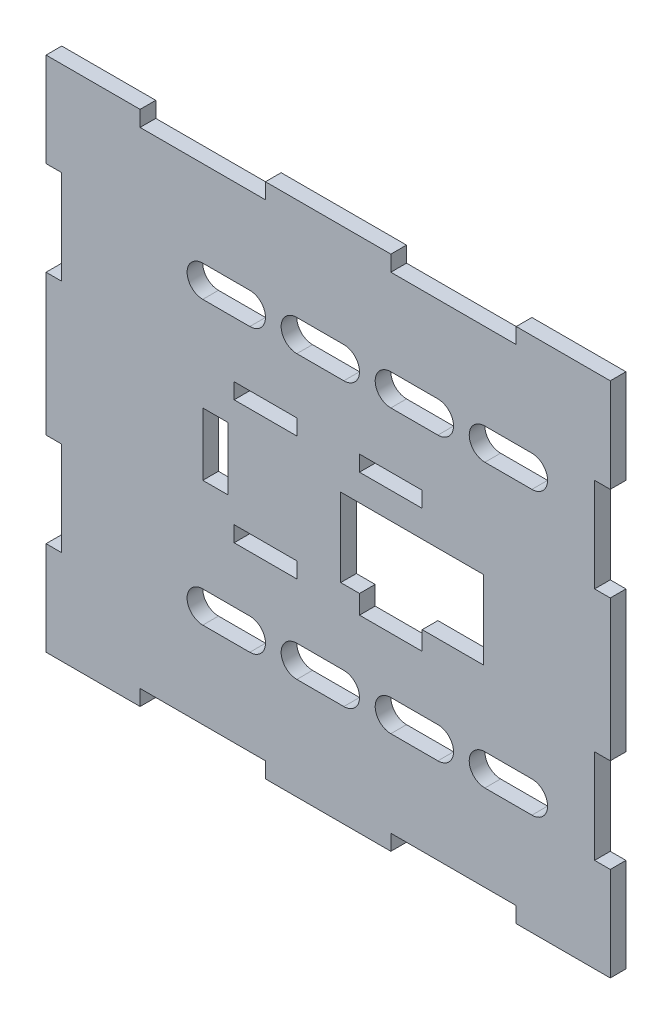
from build123d import *

# Parameters (mm, degrees)
BOSS_EXTRUDE1_DEPTH = 5
SKETCH2_W           = 20
SKETCH2_H           = 5
SKETCH2_H_2         = 6
SKETCH2_W_2         = 8
SKETCH2_H_3         = 20
SKETCH2_W_3         = 11.5
SKETCH2_H_4         = 25
SKETCH2_W_4         = 3
CUT_EXTRUDE1_DEPTH  = 10


with BuildPart() as part:
    # Sketch1 → Boss-Extrude1 (new body)
    with BuildSketch(Plane.XY):
        Polygon((6.242353031, 8.193551366), (6.242353031, 13.193551366), (-33.757646969, 13.193551366), (-33.757646969, 8.193551366), (-73.757646969, 8.193551366), (-73.757646969, 13.193551366), (-103.757646969, 13.193551366), (-103.757646969, -16.806448634), (-98.757646969, -16.806448634), (-98.757646969, -46.806448634), (-103.757646969, -46.806448634), (-103.757646969, -91.806448634), (-98.757646969, -91.806448634), (-98.757646969, -121.806448634), (-103.757646969, -121.806448634), (-103.757646969, -151.806448634), (-73.757646969, -151.806448634), (-73.757646969, -146.806448634), (-33.757646969, -146.806448634), (-33.757646969, -151.806448634), (6.242353031, -151.806448634), (6.242353031, -146.806448634), (46.242353031, -146.806448634), (46.242353031, -151.806448634), (76.242353031, -151.806448634), (76.242353031, -121.806448634), (71.242353031, -121.806448634), (71.242353031, -91.806448634), (76.242353031, -91.806448634), (76.242353031, -46.806448634), (71.242353031, -46.806448634), (71.242353031, -16.806448634), (76.242353031, -16.806448634), (76.242353031, 13.193551366), (46.242353031, 13.193551366), (46.242353031, 8.193551366), align=None)
        with BuildLine():
            ThreePointArc((21.242353031, -19.306448634), (26.242353031, -24.306448634), (21.242353031, -29.306448634))
            Line((21.242353031, -29.306448634), (6.242353031, -29.306448634))
            ThreePointArc((6.242353031, -29.306448634), (1.242353031, -24.306448634), (6.242353031, -19.306448634))
            Line((6.242353031, -19.306448634), (21.242353031, -19.306448634))
        make_face(mode=Mode.SUBTRACT)
        with BuildLine():
            Line((21.242353031, -119.306448634), (6.242353031, -119.306448634))
            ThreePointArc((6.242353031, -119.306448634), (1.242353031, -114.306448634), (6.242353031, -109.306448634))
            Line((6.242353031, -109.306448634), (21.242353031, -109.306448634))
            ThreePointArc((21.242353031, -109.306448634), (26.242353031, -114.306448634), (21.242353031, -119.306448634))
        make_face(mode=Mode.SUBTRACT)
        with BuildLine():
            Line((36.242353031, -19.306448634), (51.242353031, -19.306448634))
            ThreePointArc((51.242353031, -19.306448634), (56.242353031, -24.306448634), (51.242353031, -29.306448634))
            Line((51.242353031, -29.306448634), (36.242353031, -29.306448634))
            ThreePointArc((36.242353031, -29.306448634), (31.242353031, -24.306448634), (36.242353031, -19.306448634))
        make_face(mode=Mode.SUBTRACT)
        with BuildLine():
            ThreePointArc((51.242353031, -109.306448634), (56.242353031, -114.306448634), (51.242353031, -119.306448634))
            Line((51.242353031, -119.306448634), (36.242353031, -119.306448634))
            ThreePointArc((36.242353031, -119.306448634), (31.242353031, -114.306448634), (36.242353031, -109.306448634))
            Line((36.242353031, -109.306448634), (51.242353031, -109.306448634))
        make_face(mode=Mode.SUBTRACT)
        with BuildLine():
            Line((-53.757646969, -109.306448634), (-38.757646969, -109.306448634))
            ThreePointArc((-38.757646969, -109.306448634), (-33.757646969, -114.306448634), (-38.757646969, -119.306448634))
            Line((-38.757646969, -119.306448634), (-53.757646969, -119.306448634))
            ThreePointArc((-53.757646969, -119.306448634), (-58.757646969, -114.306448634), (-53.757646969, -109.306448634))
        make_face(mode=Mode.SUBTRACT)
        with BuildLine():
            Line((-8.757646969, -119.306448634), (-23.757646969, -119.306448634))
            ThreePointArc((-23.757646969, -119.306448634), (-28.757646969, -114.306448634), (-23.757646969, -109.306448634))
            Line((-23.757646969, -109.306448634), (-8.757646969, -109.306448634))
            ThreePointArc((-8.757646969, -109.306448634), (-3.757646969, -114.306448634), (-8.757646969, -119.306448634))
        make_face(mode=Mode.SUBTRACT)
        with BuildLine():
            Line((-53.757646969, -19.306448634), (-38.757646969, -19.306448634))
            ThreePointArc((-38.757646969, -19.306448634), (-33.757646969, -24.306448634), (-38.757646969, -29.306448634))
            Line((-38.757646969, -29.306448634), (-53.757646969, -29.306448634))
            ThreePointArc((-53.757646969, -29.306448634), (-58.757646969, -24.306448634), (-53.757646969, -19.306448634))
        make_face(mode=Mode.SUBTRACT)
        with BuildLine():
            Line((-8.757646969, -29.306448634), (-23.757646969, -29.306448634))
            ThreePointArc((-23.757646969, -29.306448634), (-28.757646969, -24.306448634), (-23.757646969, -19.306448634))
            Line((-23.757646969, -19.306448634), (-8.757646969, -19.306448634))
            ThreePointArc((-8.757646969, -19.306448634), (-3.757646969, -24.306448634), (-8.757646969, -29.306448634))
        make_face(mode=Mode.SUBTRACT)
    extrude(amount=BOSS_EXTRUDE1_DEPTH)

    # Sketch2 → Cut-Extrude1 (cut)
    with BuildSketch(Plane(origin=(0, 0, 0), x_dir=(-1, 0, 0), z_dir=(0, 0, -1))):
        with Locations((-6.242353031, -49.556448634)):
            Rectangle(SKETCH2_W, SKETCH2_H)
        with Locations((33.757646969, -49.556448634)):
            Rectangle(SKETCH2_W, SKETCH2_H)
        with Locations((33.757646969, -89.056448634)):
            Rectangle(SKETCH2_W, SKETCH2_H)
        Polygon((-16.242353031, -85.556448634), (3.757646969, -85.556448634), (9.757646969, -85.556448634), (9.757646969, -60.556448634), (-21.242353031, -60.556448634), (-21.242353031, -85.556448634), align=None)
        with Locations((-6.242353031, -88.556448634)):
            Rectangle(SKETCH2_W, SKETCH2_H_2)
        with Locations((49.757646969, -69.306448634)):
            Rectangle(SKETCH2_W_2, SKETCH2_H_3)
        with Locations((-29.992353031, -73.056448634)):
            Rectangle(SKETCH2_W_3, SKETCH2_H_4)
        with Locations((-22.742353031, -73.056448634)):
            Rectangle(SKETCH2_W_4, SKETCH2_H_4)
    extrude(amount=-CUT_EXTRUDE1_DEPTH, mode=Mode.SUBTRACT)


solid = part.part
